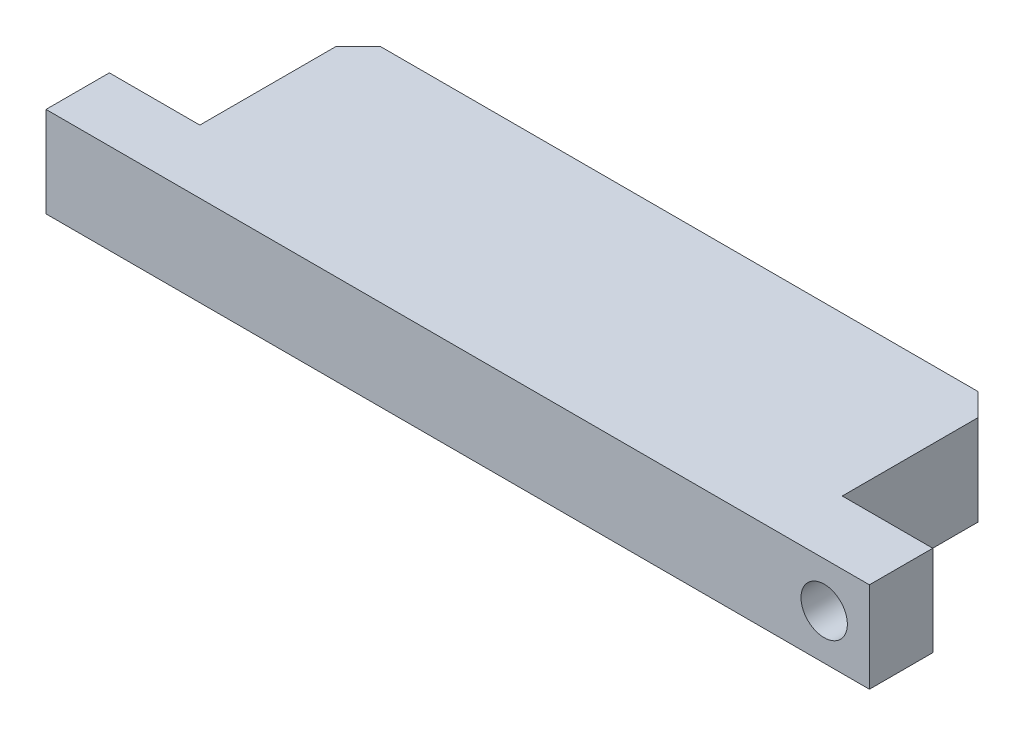
from build123d import *

# Parameters (mm, degrees)
SKETCH1_W                        = 36.4
SKETCH1_H                        = 9.8
BOSS_EXTRUDE1_DEPTH              = 4
SKETCH2_W                        = 4
SKETCH2_H                        = 6.999999999
CUT_EXTRUDE1_DEPTH               = 22.05421573
SKETCH3_W                        = 4
SKETCH3_H                        = 6.999999999
CUT_EXTRUDE2_DEPTH               = 22.05421573
F_2_05_2_05_DIAMETER_HOLE1_D     = 2.05
F_2_05_2_05_DIAMETER_HOLE1_DEPTH = 6.35
F_2_05_2_05_DIAMETER_HOLE1_TIP   = 0.615882135
F_2_05_2_05_DIAMETER_HOLE2_D     = 2.05
F_2_05_2_05_DIAMETER_HOLE2_DEPTH = 9.8
CHAMFER1_SIZE                    = 1


with BuildPart() as part:
    # Sketch1 → Boss-Extrude1 (new body)
    with BuildSketch(Plane(origin=(0, 4, 0), x_dir=(1, 0, 0), z_dir=(0, 1, 0))):
        with Locations((0, -4.9)):
            Rectangle(SKETCH1_W, SKETCH1_H)
    extrude(amount=-BOSS_EXTRUDE1_DEPTH)

    # Sketch2 → Cut-Extrude1 (cut, through all)
    with BuildSketch(Plane.XZ):
        with Locations((-16.2, 3.5)):
            Rectangle(SKETCH2_W, SKETCH2_H)
    extrude(amount=-CUT_EXTRUDE1_DEPTH, mode=Mode.SUBTRACT)

    # Sketch3 → Cut-Extrude2 (cut, through all)
    with BuildSketch(Plane.XZ):
        with Locations((16.2, 3.5)):
            Rectangle(SKETCH3_W, SKETCH3_H)
    extrude(amount=-CUT_EXTRUDE2_DEPTH, mode=Mode.SUBTRACT)

    # Ø2.05 (2.05) Diameter Hole1
    with Locations(Plane(origin=(0, 0, 0), x_dir=(-1, 0, 0), z_dir=(0, 0, -1))):
        with Locations((10, 2), (-10, 2)):
            Hole(F_2_05_2_05_DIAMETER_HOLE1_D / 2, depth=F_2_05_2_05_DIAMETER_HOLE1_DEPTH)
            with Locations((0, 0, -(F_2_05_2_05_DIAMETER_HOLE1_DEPTH + F_2_05_2_05_DIAMETER_HOLE1_TIP / 2))):  # 118° drill point
                Cone(0, F_2_05_2_05_DIAMETER_HOLE1_D / 2, F_2_05_2_05_DIAMETER_HOLE1_TIP, mode=Mode.SUBTRACT)

    # Ø2.05 (2.05) Diameter Hole2
    with Locations(Plane.XY.offset(9.8)):
        with Locations((16.2, 2)):
            Hole(F_2_05_2_05_DIAMETER_HOLE2_D / 2, depth=F_2_05_2_05_DIAMETER_HOLE2_DEPTH)

    # Chamfer1
    chamfer1_edges = [part.edges().sort_by_distance(p)[0] for p in [
        (-14.2, 2, 0),
        (14.2, 2, 0),
    ]]
    chamfer(chamfer1_edges, length=CHAMFER1_SIZE)


solid = part.part
